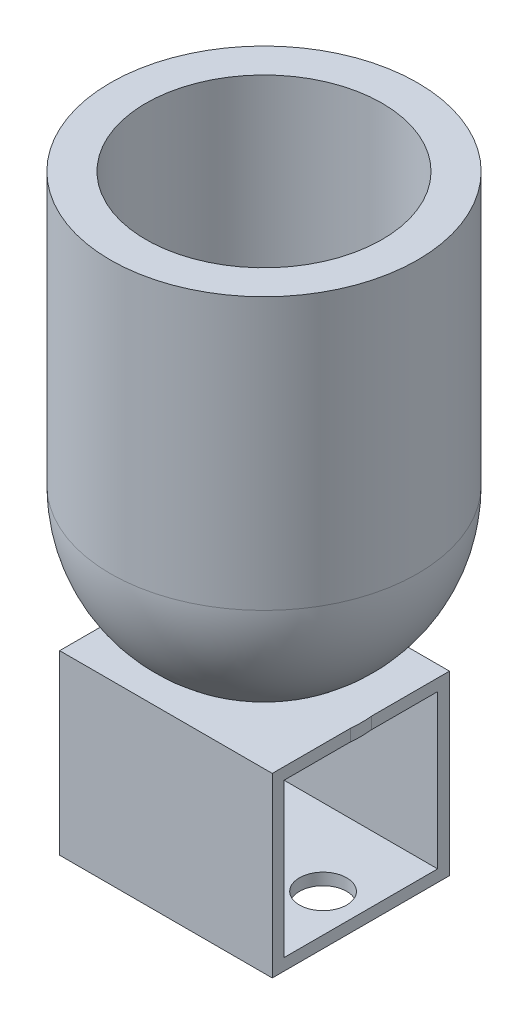
from build123d import *

# Parameters (mm, degrees)
SKETCH2_W           = 16.400211148
SKETCH2_H           = 13
BOSS_EXTRUDE1_DEPTH = 3
SKETCH3_W           = 16.430845556
SKETCH3_H           = 2.401527161
SKETCH3_H_2         = 2.320561052
CUT_EXTRUDE1_DEPTH  = 3
SKETCH4_R           = 2
CUT_EXTRUDE2_DEPTH  = 3
SKETCH5_W           = 15
SKETCH5_H           = 15
BOSS_EXTRUDE3_DEPTH = 18
SKETCH6_W           = 13
SKETCH6_H           = 13
CUT_EXTRUDE3_DEPTH  = 20
SKETCH7_R           = 2
CUT_EXTRUDE4_DEPTH  = 5


with BuildPart() as part:
    # Sketch1 → Revolve1 (revolve)
    with BuildSketch(Plane.XY, mode=Mode.PRIVATE) as revolve1_sk:
        with BuildLine():
            Line((10, 25.165087569), (10, 5.165087569))
            ThreePointArc((10, 5.165087569), (7.071067812, -1.905980243), (0, -4.834912431))
            Line((0, -4.834912431), (0, -9.834912431))
            Line((0, -9.834912431), (0, -11.124312847))
            Line((0, -11.124312847), (8.247604153, -11.124312847))
            Line((8.247604153, -11.124312847), (8.247604153, -8.124312847))
            Line((8.247604153, -8.124312847), (2, -8.124312847))
            Line((2, -8.124312847), (2, -7.680145009))
            ThreePointArc((2, -7.680145009), (9.874208829, -3.290679693), (13, 5.165087569))
            Line((13, 5.165087569), (13, 28.165087569))
            Line((13, 28.165087569), (10, 28.165087569))
            Line((10, 28.165087569), (10, 25.165087569))
        make_face()
    revolve(revolve1_sk.sketch.rotate(Axis((0, 0, 0), (0, 1, 0)), 90), axis=Axis((0, 0, 0), (0, 1, 0)))

    # Sketch2 → Boss-Extrude1 (add)
    with BuildSketch(Plane.XZ.offset(11.124312847)):
        Rectangle(SKETCH2_W, SKETCH2_H)
    extrude(amount=-BOSS_EXTRUDE1_DEPTH)

    # Sketch3 → Cut-Extrude1 (cut)
    with BuildSketch(Plane.XZ.offset(11.124312847)):
        with Locations((0.015317204, 7.700763581)):
            Rectangle(SKETCH3_W, SKETCH3_H)
        with Locations((0.015317204, -7.704987868)):
            Rectangle(SKETCH3_W, SKETCH3_H_2)
    extrude(amount=-CUT_EXTRUDE1_DEPTH, mode=Mode.SUBTRACT)

    # Sketch4 → Cut-Extrude2 (cut)
    with BuildSketch(Plane.XZ.offset(11.124312847)):
        with Locations(Location((5, 0, 0), (0, 0, 270))):
            Circle(SKETCH4_R)
        with Locations(Location((-5, 0, 0), (0, 0, 270))):
            Circle(SKETCH4_R)
    extrude(amount=-CUT_EXTRUDE2_DEPTH, mode=Mode.SUBTRACT)

    # Sketch5 → Boss-Extrude3 (add)
    with BuildSketch(Plane(origin=(8.200105574, 0, 0), x_dir=(0, 0, -1), z_dir=(1, 0, 0))):
        with Locations((0, -15.624312847)):
            Rectangle(SKETCH5_W, SKETCH5_H)
    extrude(amount=-BOSS_EXTRUDE3_DEPTH)

    # Sketch6 → Cut-Extrude3 (cut)
    with BuildSketch(Plane.ZY.offset(9.799894426)):
        with Locations((0, -15.624312847)):
            Rectangle(SKETCH6_W, SKETCH6_H)
    extrude(amount=-CUT_EXTRUDE3_DEPTH, mode=Mode.SUBTRACT)

    # Sketch7 → Cut-Extrude4 (cut)
    with BuildSketch(Plane.XZ.offset(23.124312847)):
        with Locations(Location((-5, 0, 0), (0, 0, 270))):
            Circle(SKETCH7_R)
        with Locations(Location((5, 0, 0), (0, 0, 270))):
            Circle(SKETCH7_R)
    extrude(amount=-CUT_EXTRUDE4_DEPTH, mode=Mode.SUBTRACT)


solid = part.part
